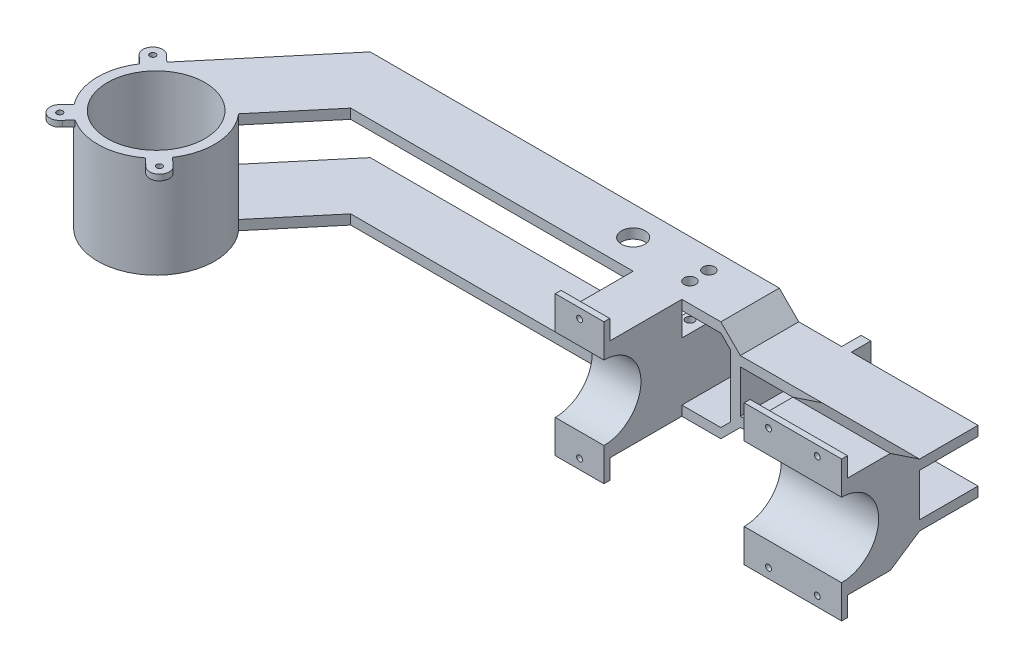
from build123d import *

# Parameters (mm, degrees)
SKETCH1_R            = 6
BOSS_EXTRUDE4_DEPTH  = 5
BOSS_EXTRUDE5_DEPTH  = 30
BOSS_EXTRUDE6_DEPTH  = 30
SKETCH11_R           = 6
BOSS_EXTRUDE7_DEPTH  = 5
BOSS_EXTRUDE8_DEPTH  = 30
BOSS_EXTRUDE9_DEPTH  = 10
CUT_EXTRUDE2_REACH   = 126.008
SKETCH14_R           = 2.2
SKETCH16_W           = 25
SKETCH16_H           = 40
BOSS_EXTRUDE10_DEPTH = 52
CUT_EXTRUDE4_REACH   = 102.668
SKETCH18_R           = 19
SKETCH19_W           = 30
SKETCH19_H           = 5
BOSS_EXTRUDE11_DEPTH = 52
BOSS_EXTRUDE12_DEPTH = 50
BOSS_EXTRUDE14_REACH = 184.628
SKETCH22_W           = 10.000000149
SKETCH22_H           = 29.829068408
SKETCH26_R           = 2.15
SKETCH26_R_2         = 2.089802204
CUT_EXTRUDE6_DEPTH   = 33
CUT_EXTRUDE7_REACH   = 180.81
SKETCH27_R           = 3
SKETCH21_W           = 25
SKETCH21_H           = 10
SKETCH21_R           = 1.5
SKETCH21_W_2         = 50
BOSS_EXTRUDE15_DEPTH = 3
BOSS_EXTRUDE16_DEPTH = 5
BOSS_EXTRUDE17_START = -52
SKETCH30_R           = 30
SKETCH30_R_2         = 25
BOSS_EXTRUDE17_DEPTH = 52
SKETCH31_R           = 1.5
BOSS_EXTRUDE18_DEPTH = 3
CIRPATTERN1_COUNT    = 3
CIRPATTERN1_ANGLE    = 180


with BuildPart() as part:
    # Sketch1 → Boss-Extrude4 (new body)
    with BuildSketch(Plane(origin=(0, 0, 0), x_dir=(1, 0, 0), z_dir=(0, 1, 0))):
        with BuildLine():
            Line((0, 15), (60, 15))
            Line((60, 15), (60, -15))
            Line((60, -15), (0, -15))
            ThreePointArc((0, -15), (-15, 0), (0, 15))
        make_face()
        with Locations(Location((0, 0, 0), (0, 0, 270))):
            Circle(SKETCH1_R, mode=Mode.SUBTRACT)
    extrude(amount=BOSS_EXTRUDE4_DEPTH)

    # Sketch8 → Boss-Extrude5 (add)
    with BuildSketch(Plane.XY.offset(15)):
        Polygon((60, 0), (70, -10), (110, -10), (110, -5), (70, -5), (60, 5), align=None)
    extrude(amount=-BOSS_EXTRUDE5_DEPTH)

    # Sketch9 → Boss-Extrude6 (add)
    with BuildSketch(Plane.XY.offset(15)):
        Polygon((70, -10), (70, -21), (65, -21), (65, -5), align=None)
    boss_extrude6 = extrude(amount=-BOSS_EXTRUDE6_DEPTH)

    # Mirror3: Boss-Extrude6 across plane
    add(boss_extrude6.mirror(Plane(origin=(70, -21, -15), x_dir=(0, 0, 1), z_dir=(0, -1, 0))))



with BuildPart() as body_2:
    # Sketch11 → Boss-Extrude7 (new body)
    with BuildSketch(Plane(origin=(0, -42, 0), x_dir=(-1, 0, 0), z_dir=(0, -1, 0))):
        with BuildLine():
            Line((0, 15), (-60, 15))
            Line((-60, 15), (-60, -15))
            Line((-60, -15), (0, -15))
            ThreePointArc((0, -15), (15, 0), (0, 15))
        make_face()
        with Locations(Location((0, 0, 0), (0, 0, 270))):
            Circle(SKETCH11_R, mode=Mode.SUBTRACT)
    extrude(amount=BOSS_EXTRUDE7_DEPTH)


with BuildPart() as part_1:
    add(part.part)

    add(body_2.part)  # Boss-Extrude8 merges body 2
    # Sketch12 → Boss-Extrude8 (add)
    with BuildSketch(Plane(origin=(0, 0, -15), x_dir=(-1, 0, 0), z_dir=(0, 0, -1))):
        Polygon((-70, -32), (-65, -37), (-60, -42), (-60, -47), (-70, -37), (-110, -37), (-110, -32), align=None)
    extrude(amount=-BOSS_EXTRUDE8_DEPTH)

    # Sketch13 → Boss-Extrude9 (add)
    with BuildSketch(Plane(origin=(0, 0, -15), x_dir=(-1, 0, 0), z_dir=(0, 0, -1))):
        Polygon((-97, -10), (-97, -37), (-92, -37), (-92, -5), (-97, -5), align=None)
    extrude(amount=BOSS_EXTRUDE9_DEPTH)

    # Sketch14 → Cut-Extrude2 (cut, up to next)
    with BuildSketch(Plane(origin=(97, 0, 0), x_dir=(0, 0, -1), z_dir=(1, 0, 0)), mode=Mode.PRIVATE) as cut_extrude2_sk1:
        with Locations((19.3, -16.05)):
            Circle(SKETCH14_R)
    cut_extrude2_tool1 = extrude(cut_extrude2_sk1.sketch, amount=-CUT_EXTRUDE2_REACH, mode=Mode.PRIVATE) & part_1.part
    # Sketch14 → Cut-Extrude2 (cut, up to next)
    with BuildSketch(Plane(origin=(97, 0, 0), x_dir=(0, 0, -1), z_dir=(1, 0, 0)), mode=Mode.PRIVATE) as cut_extrude2_sk2:
        with Locations((19.3, -25.95)):
            Circle(SKETCH14_R)
    cut_extrude2_tool2 = extrude(cut_extrude2_sk2.sketch, amount=-CUT_EXTRUDE2_REACH, mode=Mode.PRIVATE) & part_1.part
    add(cut_extrude2_tool1.solids().sort_by_distance((97, -16.05, -19.3))[0], mode=Mode.SUBTRACT)
    add(cut_extrude2_tool2.solids().sort_by_distance((97, -25.95, -19.3))[0], mode=Mode.SUBTRACT)

    # Sketch16 → Boss-Extrude10 (add)
    with BuildSketch(Plane.XZ.offset(47)):
        with Locations((27.5, 35)):
            Rectangle(SKETCH16_W, SKETCH16_H)
    extrude(amount=-BOSS_EXTRUDE10_DEPTH)

    # Sketch18 → Cut-Extrude4 (cut, up to next)
    with BuildSketch(Plane(origin=(40, 0, 0), x_dir=(0, 0, -1), z_dir=(1, 0, 0)), mode=Mode.PRIVATE) as cut_extrude4_sk1:
        with Locations((-55, -21)):
            Circle(SKETCH18_R)
    cut_extrude4_tool1 = extrude(cut_extrude4_sk1.sketch, amount=-CUT_EXTRUDE4_REACH, mode=Mode.PRIVATE) & part_1.part
    add(cut_extrude4_tool1.solids().sort_by_distance((40, -21, 55))[0], mode=Mode.SUBTRACT)

    # Sketch19 → Boss-Extrude11 (add)
    with BuildSketch(Plane(origin=(110, 0, 0), x_dir=(0, 0, -1), z_dir=(1, 0, 0))):
        with Locations((0, -7.5)):
            Rectangle(SKETCH19_W, SKETCH19_H)
        with Locations((0, -34.5)):
            Rectangle(SKETCH19_W, SKETCH19_H)
    extrude(amount=BOSS_EXTRUDE11_DEPTH)

    # Sketch20 → Boss-Extrude12 (add)
    with BuildSketch(Plane(origin=(162, 0, 0), x_dir=(0, 0, -1), z_dir=(1, 0, 0))):
        with BuildLine():
            Line((-55, 5), (-55, -2))
            ThreePointArc((-55, -2), (-36, -21), (-55, -40))
            Line((-55, -40), (-55, -47))
            Line((-55, -47), (-30, -47))
            Line((-30, -47), (-15, -37))
            Line((-15, -37), (-15, -5))
            Line((-15, -5), (-30, 5))
            Line((-30, 5), (-55, 5))
        make_face()
    extrude(amount=-BOSS_EXTRUDE12_DEPTH)

    # Sketch22 → Boss-Extrude14 (add, up to next)
    with BuildSketch(Plane(origin=(0, 0, -15), x_dir=(-1, 0, 0), z_dir=(0, 0, -1)), mode=Mode.PRIVATE) as boss_extrude14_sk1:
        with Locations((-34.999999925, -27.085465796)):
            Rectangle(SKETCH22_W, SKETCH22_H)
    boss_extrude14_tool1 = extrude(boss_extrude14_sk1.sketch, amount=-BOSS_EXTRUDE14_REACH, mode=Mode.PRIVATE) - part_1.part
    add(boss_extrude14_tool1.solids().sort_by_distance((35, -27.085466, -15))[0])

    # Sketch26 → Cut-Extrude6 (cut)
    with BuildSketch(Plane(origin=(0, 5, 0), x_dir=(1, 0, 0), z_dir=(0, 1, 0))):
        with Locations(Location((34.000000507, -4.85, 0), (0, 0, 270))):
            Circle(SKETCH26_R)
        with Locations(Location((34.000000507, 4.85, 0), (0, 0, 270))):
            Circle(SKETCH26_R_2)
    extrude(amount=-CUT_EXTRUDE6_DEPTH, mode=Mode.SUBTRACT)

    # Sketch27 → Cut-Extrude7 (cut, up to next)
    with BuildSketch(Plane(origin=(0, 5, 0), x_dir=(1, 0, 0), z_dir=(0, 1, 0)), mode=Mode.PRIVATE) as cut_extrude7_sk1:
        with Locations(Location((34.000000507, 4.85, 0), (0, 0, 270))):
            Circle(SKETCH27_R)
    cut_extrude7_tool1 = extrude(cut_extrude7_sk1.sketch, amount=-CUT_EXTRUDE7_REACH, mode=Mode.PRIVATE) & part_1.part
    # Sketch27 → Cut-Extrude7 (cut, up to next)
    with BuildSketch(Plane(origin=(0, 5, 0), x_dir=(1, 0, 0), z_dir=(0, 1, 0)), mode=Mode.PRIVATE) as cut_extrude7_sk2:
        with Locations(Location((34.000000507, -4.85, 0), (0, 0, 270))):
            Circle(SKETCH27_R)
    cut_extrude7_tool2 = extrude(cut_extrude7_sk2.sketch, amount=-CUT_EXTRUDE7_REACH, mode=Mode.PRIVATE) & part_1.part
    add(cut_extrude7_tool1.solids().sort_by_distance((34.000001, 5, -4.85))[0], mode=Mode.SUBTRACT)
    add(cut_extrude7_tool2.solids().sort_by_distance((34.000001, 5, 4.85))[0], mode=Mode.SUBTRACT)

    # Sketch21 → Boss-Extrude15 (add)
    # profile 1 of 4: a face of its own
    with BuildSketch(Plane.XY.offset(55)):
        with Locations((27.5, 10)):
            Rectangle(SKETCH21_W, SKETCH21_H)
        with Locations((27.5, 10)):
            Circle(SKETCH21_R, mode=Mode.SUBTRACT)
    # profile 2 of 4: a face of its own
    with BuildSketch(Plane.XY.offset(55)):
        with Locations((27.5, -52)):
            Rectangle(SKETCH21_W, SKETCH21_H)
        with Locations((27.5, -52)):
            Circle(SKETCH21_R, mode=Mode.SUBTRACT)
    # profile 3 of 4: a face of its own
    with BuildSketch(Plane.XY.offset(55)):
        with Locations((137, 10)):
            Rectangle(SKETCH21_W_2, SKETCH21_H)
        with Locations((124.5, 10)):
            Circle(SKETCH21_R, mode=Mode.SUBTRACT)
        with Locations((149.5, 10)):
            Circle(SKETCH21_R, mode=Mode.SUBTRACT)
    # profile 4 of 4: a face of its own
    with BuildSketch(Plane.XY.offset(55)):
        with Locations((137, -52)):
            Rectangle(SKETCH21_W_2, SKETCH21_H)
        with Locations((124.5, -52)):
            Circle(SKETCH21_R, mode=Mode.SUBTRACT)
        with Locations((149.5, -52)):
            Circle(SKETCH21_R, mode=Mode.SUBTRACT)
    extrude(amount=-BOSS_EXTRUDE15_DEPTH)

    # Sketch28 → Boss-Extrude16 (add)
    with BuildSketch(Plane.XZ.offset(47)):
        with BuildLine():
            Line((0, 15), (0, 6))
            Line((0, 6), (-6, 6))
            Line((-6, 6), (-6, -6))
            Line((-6, -6), (0, -6))
            Line((0, -6), (0, -15))
            Line((0, -15), (-150, -15))
            Line((-150, -15), (-201.423008775, 46.28355545))
            ThreePointArc((-201.423008775, 46.28355545), (-178.836514307, 36.028181748), (-156.25001984, 46.28355545))
            Line((-156.25001984, 46.28355545), (-130, 15))
            Line((-130, 15), (0, 15))
        make_face()
    boss_extrude16 = extrude(amount=-BOSS_EXTRUDE16_DEPTH)

    # Mirror4: Boss-Extrude16 across plane
    add(boss_extrude16.mirror(Plane(origin=(0, -21, 0), x_dir=(0, 0, 1), z_dir=(0, -1, 0))))

    # Sketch30 → Boss-Extrude17 (add)
    with BuildSketch(Plane.XZ.offset(47).offset(BOSS_EXTRUDE17_START)):
        with Locations(Location((-178.836514307, 66.028181748, 0), (0, 0, 221.159253818))):
            Circle(SKETCH30_R)
        with Locations(Location((-178.836514307, 66.028181748, 0), (0, 0, 270))):
            Circle(SKETCH30_R_2, mode=Mode.SUBTRACT)
    extrude(amount=BOSS_EXTRUDE17_DEPTH)

    # Sketch31 → Boss-Extrude18 (add)
    with BuildSketch(Plane(origin=(0, 5, 0), x_dir=(1, 0, 0), z_dir=(0, 1, 0))):
        with BuildLine():
            Line((-160.566387425, -89.823190966), (-157.209024914, -92.955990517))
            ThreePointArc((-157.209024914, -92.955990517), (-149.591093676, -93.317472176), (-150.478249183, -85.742744428))
            Line((-150.478249183, -85.742744428), (-153.835611693, -82.609944877))
            ThreePointArc((-153.835611693, -82.609944877), (-156.902448834, -86.495149569), (-160.566387425, -89.823190966))
        make_face()
        with Locations(Location((-153.246771255, -89.906310873, 0), (0, 0, 270))):
            Circle(SKETCH31_R, mode=Mode.SUBTRACT)
    boss_extrude18 = extrude(amount=-BOSS_EXTRUDE18_DEPTH)

    # CirPattern1: Boss-Extrude18 ×3 about axis
    cirpattern1_axis = Axis((-178.836514307, 0, 66.028181748), (0, -1, 0))
    for i in range(1, CIRPATTERN1_COUNT):
        add(boss_extrude18.rotate(cirpattern1_axis, i * CIRPATTERN1_ANGLE / (CIRPATTERN1_COUNT - 1)))


solid = part_1.part
